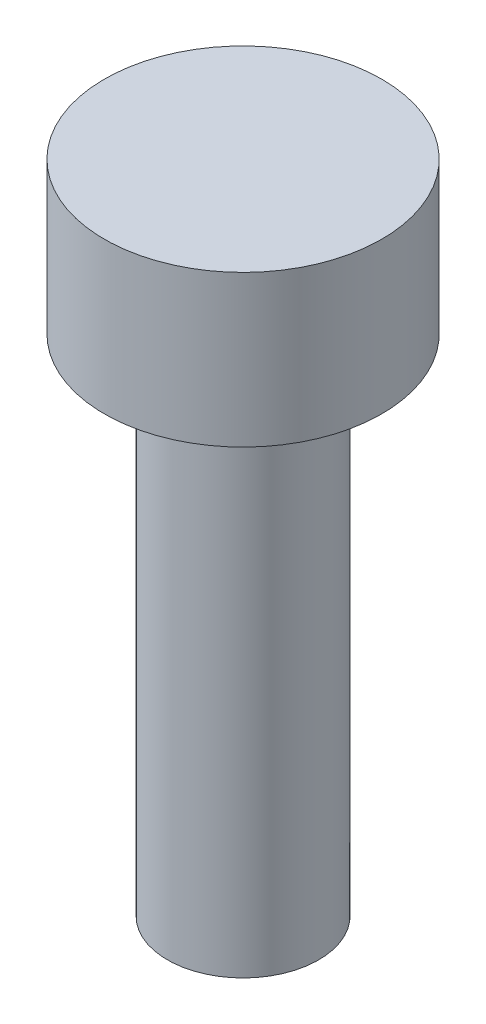
from build123d import *


with BuildPart() as part:
    # Эскиз1 → Повернуть1 (revolve)
    with BuildSketch(Plane.XY, mode=Mode.PRIVATE) as revolve_1_sk:
        Polygon((0, 13), (2.75, 13), (2.75, 10), (1.5, 10), (1.5, 0), (0, 0), align=None)
    revolve(revolve_1_sk.sketch.rotate(Axis((0, 0, 0), (0, 1, 0)), 90), axis=Axis((0, 0, 0), (0, 1, 0)))


solid = part.part
